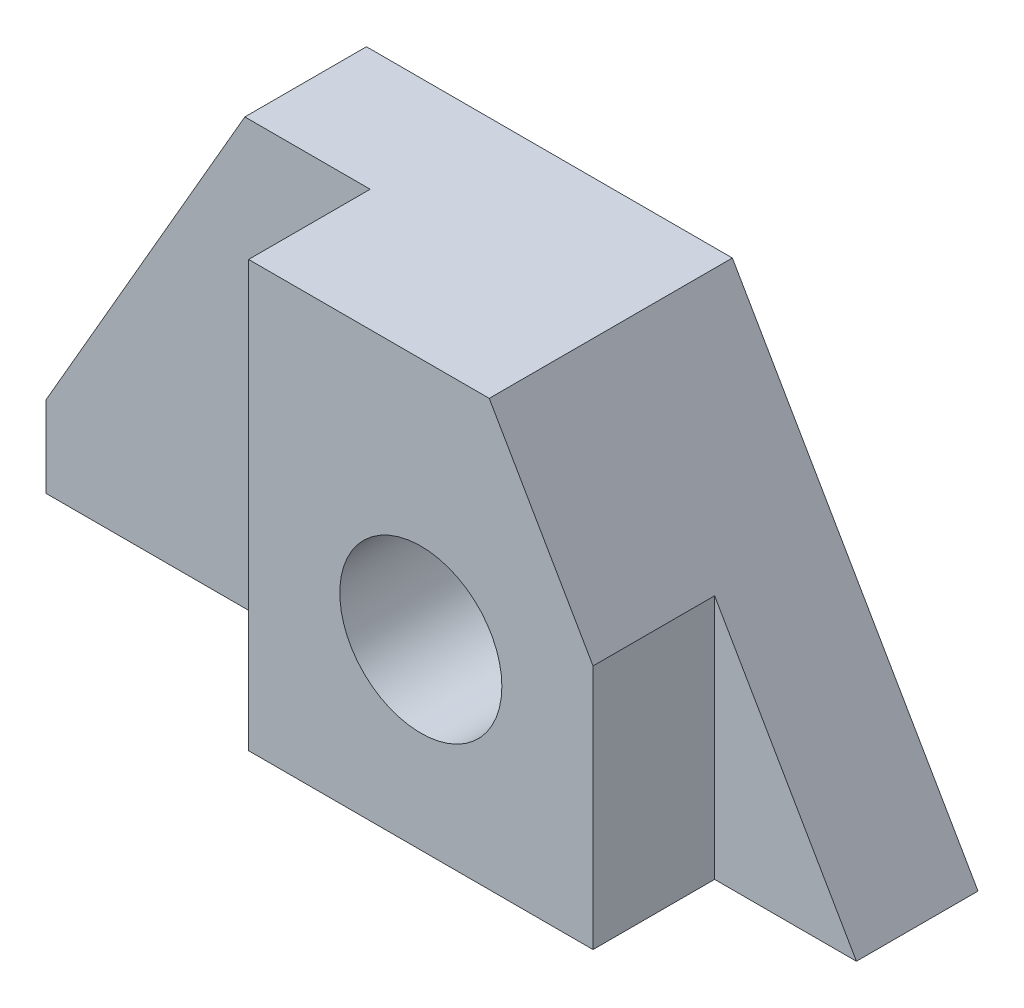
from build123d import *

# Parameters (mm, degrees)
BOSS_EXTRUDE1_DEPTH   = 19.05
BOSS_EXTRUDE1_2_DEPTH = 19.05
SKETCH1_3_R           = 12.7
BOSS_EXTRUDE2_DEPTH   = 38.1


with BuildPart() as part:
    # Sketch1 → Boss-Extrude1 (new body)
    with BuildSketch(Plane.XY):
        Polygon((-58.138751056, 66.675), (-89.301231836, 12.7), (-89.301231836, 0), (-38.501231836, 0), (-38.501231836, 66.675), align=None)
    extrude(amount=BOSS_EXTRUDE1_DEPTH)



with BuildPart() as body_2:
    # Sketch1 → Boss-Extrude1 2 (new body)
    with BuildSketch(Plane.XY):
        Polygon((15.473768164, 38.494829198), (15.473768164, 0), (37.698768164, 0), align=None)
    extrude(amount=BOSS_EXTRUDE1_2_DEPTH)


with BuildPart() as part_1:
    add(part.part)

    add(body_2.part)  # Boss-Extrude2 merges body 2
    # Sketch1<3> → Boss-Extrude2 (add)
    with BuildSketch(Plane.XY):
        Polygon((-38.501231836, 66.675), (-38.501231836, 0), (15.473768164, 0), (15.473768164, 38.494829198), (-0.796061034, 66.675), align=None)
        with Locations((-11.513731836, 28.575)):
            Circle(SKETCH1_3_R, mode=Mode.SUBTRACT)
    extrude(amount=BOSS_EXTRUDE2_DEPTH)


solid = part_1.part
